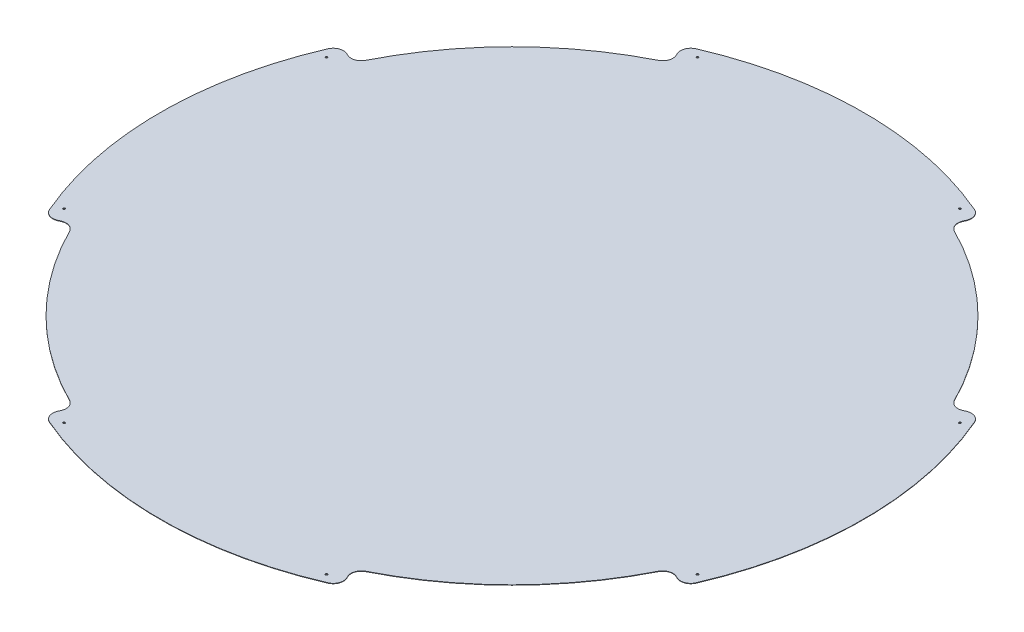
from build123d import *

# Parameters (mm, degrees)
SKETCH1_R           = 0.5
BOSS_EXTRUDE1_DEPTH = 0.19


with BuildPart() as part:
    # Sketch1 → Boss-Extrude1 (new body)
    with BuildSketch(Plane(origin=(0, 0, 0), x_dir=(1, 0, 0), z_dir=(0, 1, 0))):
        with BuildLine():
            Line((70.757013136, 151.738904346), (70.334205326, 150.83219007))
            ThreePointArc((70.334205326, 150.83219007), (70.142130859, 147.07974632), (72.617523713, 144.253059759))
            ThreePointArc((72.617523713, 144.253059759), (114.197745162, 114.197745162), (144.253059759, 72.617523713))
            ThreePointArc((144.253059759, 72.617523713), (147.07974632, 70.142130859), (150.83219007, 70.334205326))
            Line((150.83219007, 70.334205326), (151.738904346, 70.757013136))
            ThreePointArc((151.738904346, 70.757013136), (155.63203997, 70.897887093), (158.44459254, 68.202354028))
            ThreePointArc((158.44459254, 68.202354028), (172.5, 0), (158.44459254, -68.202354028))
            ThreePointArc((158.44459254, -68.202354028), (155.63203997, -70.897887093), (151.738904346, -70.757013136))
            Line((151.738904346, -70.757013136), (150.83219007, -70.334205326))
            ThreePointArc((150.83219007, -70.334205326), (147.07974632, -70.142130859), (144.253059759, -72.617523713))
            ThreePointArc((144.253059759, -72.617523713), (114.197745162, -114.197745162), (72.617523713, -144.253059759))
            ThreePointArc((72.617523713, -144.253059759), (70.142130859, -147.07974632), (70.334205326, -150.83219007))
            Line((70.334205326, -150.83219007), (70.757013136, -151.738904346))
            ThreePointArc((70.757013136, -151.738904346), (70.897887093, -155.63203997), (68.202354028, -158.44459254))
            ThreePointArc((68.202354028, -158.44459254), (0, -172.5), (-68.202354028, -158.44459254))
            ThreePointArc((-68.202354028, -158.44459254), (-70.897887093, -155.63203997), (-70.757013136, -151.738904346))
            Line((-70.757013136, -151.738904346), (-70.334205326, -150.83219007))
            ThreePointArc((-70.334205326, -150.83219007), (-70.142130859, -147.07974632), (-72.617523713, -144.253059759))
            ThreePointArc((-72.617523713, -144.253059759), (-114.197745162, -114.197745162), (-144.253059759, -72.617523713))
            ThreePointArc((-144.253059759, -72.617523713), (-147.07974632, -70.142130859), (-150.83219007, -70.334205326))
            Line((-150.83219007, -70.334205326), (-151.738904346, -70.757013136))
            ThreePointArc((-151.738904346, -70.757013136), (-155.63203997, -70.897887093), (-158.44459254, -68.202354028))
            ThreePointArc((-158.44459254, -68.202354028), (-172.5, 0), (-158.44459254, 68.202354028))
            ThreePointArc((-158.44459254, 68.202354028), (-155.63203997, 70.897887093), (-151.738904346, 70.757013136))
            Line((-151.738904346, 70.757013136), (-150.83219007, 70.334205326))
            ThreePointArc((-150.83219007, 70.334205326), (-147.07974632, 70.142130859), (-144.253059759, 72.617523713))
            ThreePointArc((-144.253059759, 72.617523713), (-114.197745162, 114.197745162), (-72.617523713, 144.253059759))
            ThreePointArc((-72.617523713, 144.253059759), (-70.142130859, 147.07974632), (-70.334205326, 150.83219007))
            Line((-70.334205326, 150.83219007), (-70.757013136, 151.738904346))
            ThreePointArc((-70.757013136, 151.738904346), (-70.897887093, 155.63203997), (-68.202354028, 158.44459254))
            ThreePointArc((-68.202354028, 158.44459254), (0, 172.5), (68.202354028, 158.44459254))
            ThreePointArc((68.202354028, 158.44459254), (70.897887093, 155.63203997), (70.757013136, 151.738904346))
        make_face()
        with Locations(Location((-64.290816637, 155.211761462, 0), (0, 0, 270))):
            Circle(SKETCH1_R, mode=Mode.SUBTRACT)
        with Locations(Location((64.290816637, 155.211761462, 0), (0, 0, 270))):
            Circle(SKETCH1_R, mode=Mode.SUBTRACT)
        with Locations(Location((155.211761462, 64.290816637, 0), (0, 0, 270))):
            Circle(SKETCH1_R, mode=Mode.SUBTRACT)
        with Locations(Location((155.211761462, -64.290816637, 0), (0, 0, 270))):
            Circle(SKETCH1_R, mode=Mode.SUBTRACT)
        with Locations(Location((64.290816637, -155.211761462, 0), (0, 0, 270))):
            Circle(SKETCH1_R, mode=Mode.SUBTRACT)
        with Locations(Location((-64.290816637, -155.211761462, 0), (0, 0, 270))):
            Circle(SKETCH1_R, mode=Mode.SUBTRACT)
        with Locations(Location((-155.211761462, -64.290816637, 0), (0, 0, 270))):
            Circle(SKETCH1_R, mode=Mode.SUBTRACT)
        with Locations(Location((-155.211761462, 64.290816637, 0), (0, 0, 270))):
            Circle(SKETCH1_R, mode=Mode.SUBTRACT)
    extrude(amount=BOSS_EXTRUDE1_DEPTH)


solid = part.part
